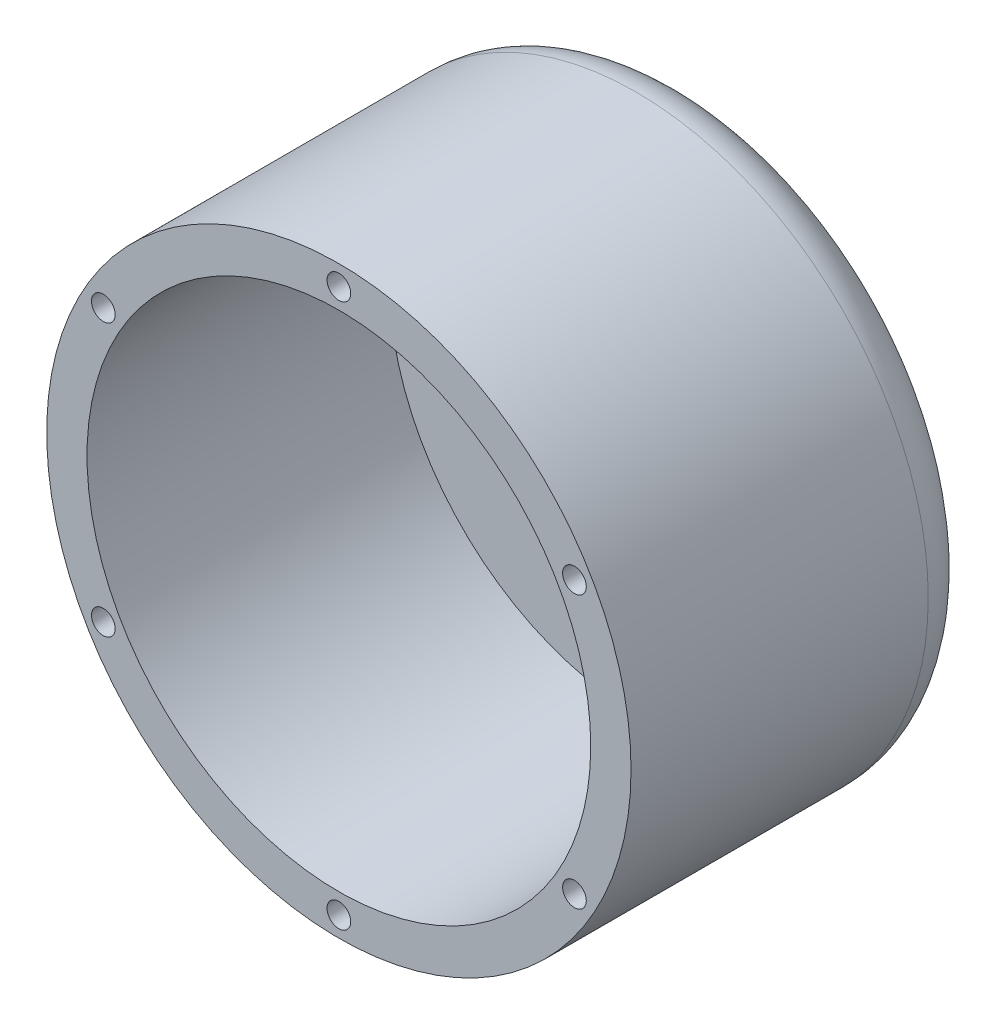
from build123d import *

# Parameters (mm, degrees)
SKETCH2_W          = 50
SKETCH2_H          = 9
SKETCH2_W_2        = 8
SKETCH2_H_2        = 60
SKETCH3_R          = 2.35
CUT_EXTRUDE1_DEPTH = 6
CUT_EXTRUDE2_REACH = 109.187
SKETCH4_R          = 1.5
SKETCH4_W          = 41
SKETCH4_H          = 20
FILLET1_R          = 10


with BuildPart() as part:
    # Sketch2 → Revolve1 (revolve)
    with BuildSketch(Plane(origin=(0, 0, 0), x_dir=(1, 0, 0), z_dir=(0, 1, 0))):
        with Locations((25, 64.5)):
            Rectangle(SKETCH2_W, SKETCH2_H)
        with Locations((54, 64.5)):
            Rectangle(SKETCH2_W_2, SKETCH2_H)
        with Locations((54, 30)):
            Rectangle(SKETCH2_W_2, SKETCH2_H_2)
    revolve(axis=Axis((0, 0, 1000), (0, 0, -1)))

    # Sketch3 → Cut-Extrude1 (cut)
    with BuildSketch(Plane.XY):
        with Locations((46.765371804, 27)):
            Circle(SKETCH3_R)
        with Locations((0, 54)):
            Circle(SKETCH3_R)
        with Locations((46.765371804, -27)):
            Circle(SKETCH3_R)
        with Locations((0, -54)):
            Circle(SKETCH3_R)
        with Locations((-46.765371804, -27)):
            Circle(SKETCH3_R)
        with Locations((-46.765371804, 27)):
            Circle(SKETCH3_R)
    extrude(amount=-CUT_EXTRUDE1_DEPTH, mode=Mode.SUBTRACT)

    # Sketch4 → Cut-Extrude2 (cut, up to next)
    with BuildSketch(Plane(origin=(0, 0, -69), x_dir=(-1, 0, 0), z_dir=(0, 0, -1)), mode=Mode.PRIVATE) as cut_extrude2_sk1:
        with Locations((15, 5)):
            Circle(SKETCH4_R)
    cut_extrude2_tool1 = extrude(cut_extrude2_sk1.sketch, amount=-CUT_EXTRUDE2_REACH, mode=Mode.PRIVATE) & part.part
    # Sketch4 → Cut-Extrude2 (cut, up to next)
    with BuildSketch(Plane(origin=(0, 0, -69), x_dir=(-1, 0, 0), z_dir=(0, 0, -1)), mode=Mode.PRIVATE) as cut_extrude2_sk2:
        with Locations((15, -5)):
            Circle(SKETCH4_R)
    cut_extrude2_tool2 = extrude(cut_extrude2_sk2.sketch, amount=-CUT_EXTRUDE2_REACH, mode=Mode.PRIVATE) & part.part
    # Sketch4 → Cut-Extrude2 (cut, up to next)
    with BuildSketch(Plane(origin=(0, 0, -69), x_dir=(-1, 0, 0), z_dir=(0, 0, -1)), mode=Mode.PRIVATE) as cut_extrude2_sk3:
        with Locations((-33, -5)):
            Circle(SKETCH4_R)
    cut_extrude2_tool3 = extrude(cut_extrude2_sk3.sketch, amount=-CUT_EXTRUDE2_REACH, mode=Mode.PRIVATE) & part.part
    # Sketch4 → Cut-Extrude2 (cut, up to next)
    with BuildSketch(Plane(origin=(0, 0, -69), x_dir=(-1, 0, 0), z_dir=(0, 0, -1)), mode=Mode.PRIVATE) as cut_extrude2_sk4:
        with Locations((-33, 5)):
            Circle(SKETCH4_R)
    cut_extrude2_tool4 = extrude(cut_extrude2_sk4.sketch, amount=-CUT_EXTRUDE2_REACH, mode=Mode.PRIVATE) & part.part
    # Sketch4 → Cut-Extrude2 (cut, up to next)
    with BuildSketch(Plane(origin=(0, 0, -69), x_dir=(-1, 0, 0), z_dir=(0, 0, -1)), mode=Mode.PRIVATE) as cut_extrude2_sk5:
        with Locations((-9, 0)):
            Rectangle(SKETCH4_W, SKETCH4_H)
    cut_extrude2_tool5 = extrude(cut_extrude2_sk5.sketch, amount=-CUT_EXTRUDE2_REACH, mode=Mode.PRIVATE) & part.part
    add(cut_extrude2_tool1.solids().sort_by_distance((-15, 5, -69))[0], mode=Mode.SUBTRACT)
    add(cut_extrude2_tool2.solids().sort_by_distance((-15, -5, -69))[0], mode=Mode.SUBTRACT)
    add(cut_extrude2_tool3.solids().sort_by_distance((33, -5, -69))[0], mode=Mode.SUBTRACT)
    add(cut_extrude2_tool4.solids().sort_by_distance((33, 5, -69))[0], mode=Mode.SUBTRACT)
    add(cut_extrude2_tool5.solids().sort_by_distance((9, 0, -69))[0], mode=Mode.SUBTRACT)

    # Fillet1
    fillet1_edges = [part.edges().sort_by_distance(p)[0] for p in [
        (-58, 0, -69),
    ]]
    fillet(fillet1_edges, radius=FILLET1_R)


solid = part.part
